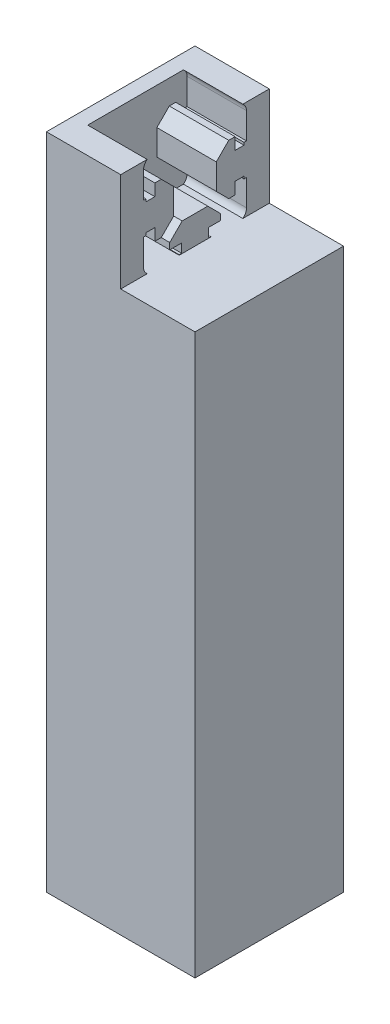
from build123d import *

# Parameters (mm, degrees)
SKETCH_2_W      = 30
SKETCH_2_H      = 30
EXTRUDE_1_DEPTH = 113
EXTRUDE_2_DEPTH = 15
SKETCH_4_W      = 30
SKETCH_4_H      = 20
EXTRUDE_4_DEPTH = 3


with BuildPart() as part:
    # 草图2 → 凸台-拉伸1 (new body)
    with BuildSketch(Plane(origin=(0, 0, 0), x_dir=(1, 0, 0), z_dir=(0, 1, 0))):
        with Locations((15, 15)):
            Rectangle(SKETCH_2_W, SKETCH_2_H)
    extrude(amount=EXTRUDE_1_DEPTH)

    # 草图3 → 凸台-拉伸2 (add)
    with BuildSketch(Plane.ZY):
        with BuildLine():
            Line((-30, 113), (-24.666190379, 113))
            ThreePointArc((-24.666190379, 113), (-25.206716397, 113.665063392), (-25.4, 114.5))
            Line((-25.4, 114.5), (-25.4, 119.8))
            Line((-25.4, 119.8), (-24.9, 119.8))
            Line((-24.9, 119.8), (-24.9, 120.3))
            Line((-24.9, 120.3), (-23.1, 120.3))
            Line((-23.1, 120.3), (-23.1, 117.9))
            Line((-23.1, 117.9), (-21.815685425, 117.9))
            Line((-21.815685425, 117.9), (-19.3, 120.415685425))
            Line((-19.3, 120.415685425), (-19.3, 125.584314575))
            Line((-19.3, 125.584314575), (-21.815685425, 128.1))
            Line((-21.815685425, 128.1), (-23.1, 128.1))
            Line((-23.1, 128.1), (-23.1, 125.7))
            Line((-23.1, 125.7), (-24.9, 125.7))
            Line((-24.9, 125.7), (-24.9, 126.2))
            Line((-24.9, 126.2), (-25.4, 126.2))
            Line((-25.4, 126.2), (-25.4, 131.5))
            ThreePointArc((-25.4, 131.5), (-25.206716397, 132.334936608), (-24.666190379, 133))
            Line((-24.666190379, 133), (-30, 133))
            Line((-30, 133), (-30, 113))
        make_face()
        Polygon((-18.2, 113.1), (-18.2, 113), (-11.8, 113), (-11.8, 113.1), (-12.3, 113.1), (-12.3, 114.9), (-9.9, 114.9), (-9.9, 116.184314575), (-12.415685425, 118.7), (-17.584314575, 118.7), (-20.1, 116.184314575), (-20.1, 114.9), (-17.7, 114.9), (-17.7, 113.1), align=None)
        with BuildLine():
            ThreePointArc((-4.6, 114.5), (-4.793283603, 113.665063392), (-5.333809621, 113))
            Line((-5.333809621, 113), (0, 113))
            Line((0, 113), (0, 133))
            Line((0, 133), (-5.333809621, 133))
            ThreePointArc((-5.333809621, 133), (-4.793283603, 132.334936608), (-4.6, 131.5))
            Line((-4.6, 131.5), (-4.6, 126.2))
            Line((-4.6, 126.2), (-5.1, 126.2))
            Line((-5.1, 126.2), (-5.1, 125.7))
            Line((-5.1, 125.7), (-6.9, 125.7))
            Line((-6.9, 125.7), (-6.9, 128.1))
            Line((-6.9, 128.1), (-8.184314575, 128.1))
            Line((-8.184314575, 128.1), (-10.7, 125.584314575))
            Line((-10.7, 125.584314575), (-10.7, 120.415685425))
            Line((-10.7, 120.415685425), (-8.184314575, 117.9))
            Line((-8.184314575, 117.9), (-6.9, 117.9))
            Line((-6.9, 117.9), (-6.9, 120.3))
            Line((-6.9, 120.3), (-5.1, 120.3))
            Line((-5.1, 120.3), (-5.1, 119.8))
            Line((-5.1, 119.8), (-4.6, 119.8))
            Line((-4.6, 119.8), (-4.6, 114.5))
        make_face()
    extrude(amount=-EXTRUDE_2_DEPTH)

    # 草图4 → 凸台-拉伸4 (add)
    with BuildSketch(Plane.ZY):
        with Locations((-15, 123)):
            Rectangle(SKETCH_4_W, SKETCH_4_H)
    extrude(amount=-EXTRUDE_4_DEPTH)


solid = part.part
